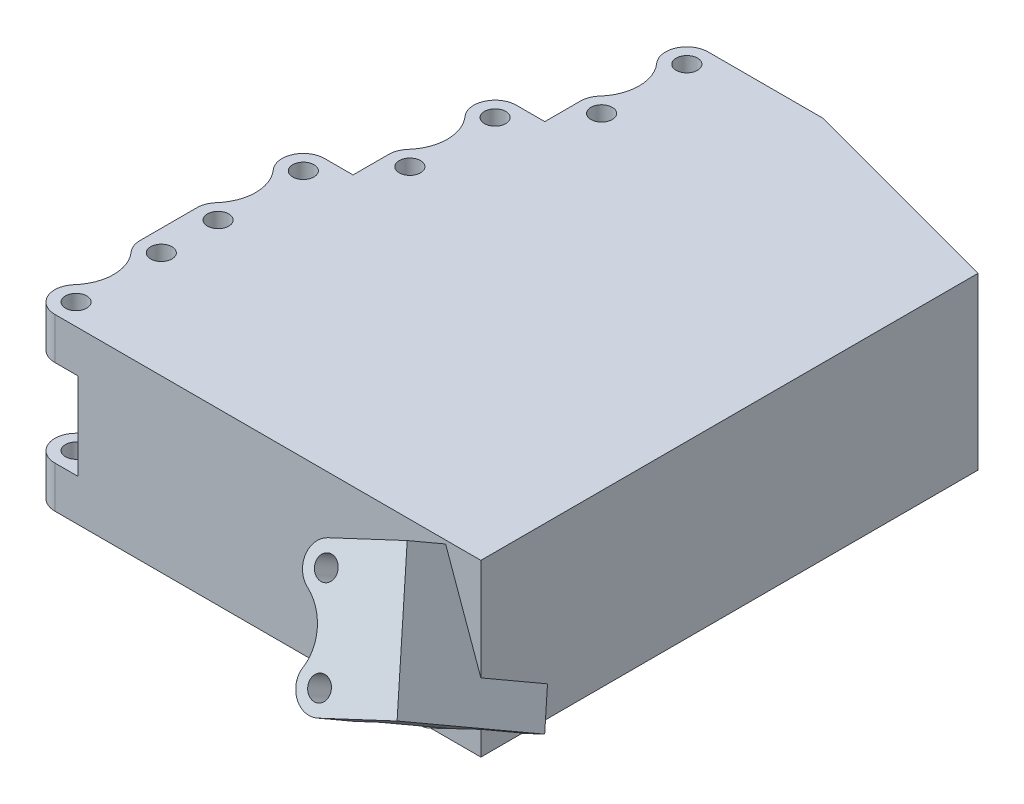
from build123d import *

# Parameters (mm, degrees)
SKETCH1_R           = 1.5
BOSS_EXTRUDE1_DEPTH = 12
SKETCH2_R           = 1.5
BOSS_EXTRUDE2_DEPTH = 12
CUT_EXTRUDE1_DEPTH  = 6.125
CUT_EXTRUDE2_DEPTH  = 6.125


with BuildPart() as part:
    # Sketch1 → Boss-Extrude1 (new, symmetric)
    with BuildSketch(Plane(origin=(0, 0, 0), x_dir=(1, 0, 0), z_dir=(0, 1, 0))):
        with BuildLine():
            Line((-20, 41), (-49.856406461, 49))
            Line((-49.856406461, 49), (-66, 49))
            ThreePointArc((-66, 49), (-68.738612788, 47.224744871), (-68.236067977, 44))
            ThreePointArc((-68.236067977, 44), (-66.708203932, 40), (-68.236067977, 36))
            ThreePointArc((-68.236067977, 36), (-68.802517077, 35.070466269), (-69, 34))
            Line((-69, 34), (-69, 31))
            Line((-69, 31), (-69, 29))
            Line((-69, 29), (-73, 29))
            ThreePointArc((-73, 29), (-75.738612788, 27.224744871), (-75.236067977, 24))
            ThreePointArc((-75.236067977, 24), (-73.708203932, 20), (-75.236067977, 16))
            ThreePointArc((-75.236067977, 16), (-75.802517077, 15.070466269), (-76, 14))
            Line((-76, 14), (-76, 11))
            Line((-76, 11), (-76, 9))
            Line((-76, 9), (-80, 9))
            ThreePointArc((-80, 9), (-82.738612788, 7.224744871), (-82.236067977, 4))
            ThreePointArc((-82.236067977, 4), (-80.708203932, 0), (-82.236067977, -4))
            ThreePointArc((-82.236067977, -4), (-82.802517077, -4.929533731), (-83, -6))
            Line((-83, -6), (-83, -9))
            Line((-83, -9), (-83, -11))
            Line((-83, -11), (-83, -14))
            ThreePointArc((-83, -14), (-82.802517077, -15.070466269), (-82.236067977, -16))
            ThreePointArc((-82.236067977, -16), (-80.708203932, -20), (-82.236067977, -24))
            ThreePointArc((-82.236067977, -24), (-82.738612788, -27.224744871), (-80, -29))
            Line((-80, -29), (-20, -29))
            Line((-20, -29), (-20, 41))
        make_face()
        with Locations((-66, 46)):
            Circle(SKETCH1_R, mode=Mode.SUBTRACT)
        with Locations((-66, 34)):
            Circle(SKETCH1_R, mode=Mode.SUBTRACT)
        with Locations((-73, 26)):
            Circle(SKETCH1_R, mode=Mode.SUBTRACT)
        with Locations((-73, 14)):
            Circle(SKETCH1_R, mode=Mode.SUBTRACT)
        with Locations((-80, 6)):
            Circle(SKETCH1_R, mode=Mode.SUBTRACT)
        with Locations((-80, -6)):
            Circle(SKETCH1_R, mode=Mode.SUBTRACT)
        with Locations((-80, -14)):
            Circle(SKETCH1_R, mode=Mode.SUBTRACT)
        with Locations((-80, -26)):
            Circle(SKETCH1_R, mode=Mode.SUBTRACT)
    extrude(amount=BOSS_EXTRUDE1_DEPTH, both=True)

    # Sketch3 → Cut-Extrude1 (cut, symmetric)
    with BuildSketch(Plane(origin=(0, 0, 0), x_dir=(1, 0, 0), z_dir=(0, 1, 0))):
        Polygon((-62.75, 49), (-62.75, 29), (-69.75, 29), (-69.75, 9), (-76.75, 9), (-76.75, -29), (-83, -29), (-83, 49), align=None)
    extrude(amount=CUT_EXTRUDE1_DEPTH, both=True, mode=Mode.SUBTRACT)


with BuildPart() as body_2:
    # Sketch2 → Boss-Extrude2 (new, symmetric)
    with BuildSketch(Plane(origin=(0, 12.557368355, 21.75), x_dir=(1, 0, 0), z_dir=(0, 0.499999999999998, 0.8660254037844398))):
        with BuildLine():
            Line((-34.205355566, -8.358249884), (-24.966560241, -4.53141556))
            Line((-24.966560241, -4.53141556), (-18.078258458, -21.161247145))
            Line((-18.078258458, -21.161247145), (-27.317053784, -24.988081469))
            ThreePointArc((-27.317053784, -24.988081469), (-30.526562811, -24.395981332), (-31.296328383, -21.224389975))
            ThreePointArc((-31.296328383, -21.224389975), (-31.415499793, -16.944183588), (-34.357795842, -13.833353715))
            ThreePointArc((-34.357795842, -13.833353715), (-36.056143142, -11.046393504), (-34.205355566, -8.358249884))
        make_face()
        with Locations((-33.057305269, -11.129888481)):
            Circle(SKETCH2_R, mode=Mode.SUBTRACT)
        with Locations((-28.465104081, -22.216442871)):
            Circle(SKETCH2_R, mode=Mode.SUBTRACT)
    extrude(amount=BOSS_EXTRUDE2_DEPTH, both=True)


with BuildPart() as cut_extrude2_tool:
    # Sketch4 → Cut-Extrude2 (new, symmetric)
    with BuildSketch(Plane(origin=(0, 12.557368355, 21.75), x_dir=(1, 0, 0), z_dir=(0, 0.499999999999998, 0.8660254037844398))):
        Polygon((-31.202747086, -7.114528729), (-24.314445303, -23.744360314), (-30.088692381, -26.136131766), (-36.976994164, -9.506300181), align=None)
    extrude(amount=CUT_EXTRUDE2_DEPTH, both=True)


with BuildPart() as part_1:
    add(part.part)

    # Cut-Extrude2: cut by cut_extrude2_tool
    add(cut_extrude2_tool.part, mode=Mode.SUBTRACT)


with BuildPart() as body_2_1:
    add(body_2.part)

    # Cut-Extrude2: cut by cut_extrude2_tool
    add(cut_extrude2_tool.part, mode=Mode.SUBTRACT)


solid = Compound([part_1.part, body_2_1.part])
